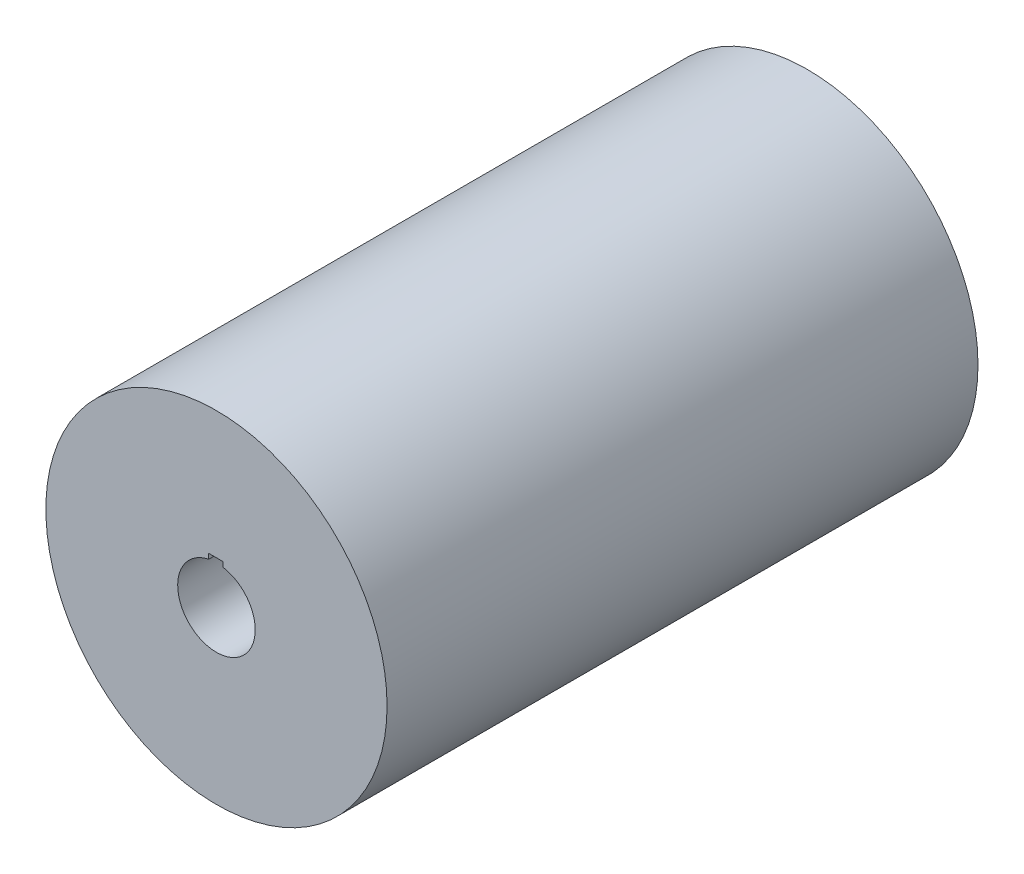
from build123d import *

# Parameters (mm, degrees)
SKETCH15_R               = 11
BOSS_EXTRUDE4_DEPTH      = 50.8
CUT_EXTRUDE9_DEPTH       = 25.4
CUT_EXTRUDE9_DEPTH_BACK  = 50.8
SKETCH16_R               = 5
SKETCH17_R               = 2.5
CUT_EXTRUDE10_DEPTH      = 25.4
SKETCH20_W               = 0.929150013
SKETCH20_H               = 0.563484587
CUT_EXTRUDE11_DEPTH      = 25.4
SKETCH22_R               = 3.175
CUT_EXTRUDE14_DEPTH      = 12
CUT_EXTRUDE15_DEPTH      = 12.7
CUT_EXTRUDE15_DEPTH_BACK = 10
SKETCH33_R               = 11


with BuildPart() as part:
    # Sketch15 → Boss-Extrude4 (new body)
    with BuildSketch(Plane.XY):
        Circle(SKETCH15_R)
    extrude(amount=BOSS_EXTRUDE4_DEPTH)

    # Sketch16 → Cut-Extrude9 (cut, two sides: drawn at the far end of the back side and taken through both)
    with BuildSketch(Plane.XY.offset(-CUT_EXTRUDE9_DEPTH_BACK)):
        Circle(SKETCH16_R)
    extrude(amount=CUT_EXTRUDE9_DEPTH + CUT_EXTRUDE9_DEPTH_BACK, mode=Mode.SUBTRACT)

    # Sketch17 → Cut-Extrude10 (cut)
    with BuildSketch(Plane.XY.offset(50.8)):
        Circle(SKETCH17_R)
    extrude(amount=-CUT_EXTRUDE10_DEPTH, mode=Mode.SUBTRACT)

    # Sketch20 → Cut-Extrude11 (cut)
    with BuildSketch(Plane.XY.offset(50.8)):
        with Locations((-0.035424993, 2.498467219)):
            Rectangle(SKETCH20_W, SKETCH20_H)
    extrude(amount=-CUT_EXTRUDE11_DEPTH, mode=Mode.SUBTRACT)

    # Sketch22 → Cut-Extrude14 (cut)
    with BuildSketch(Plane(origin=(0, 0, 0), x_dir=(1, 0, 0), z_dir=(0, 1, 0))):
        with Locations(Location((0, -39.506560459, 0), (0, 0, 270))):
            Circle(SKETCH22_R)
    extrude(amount=-CUT_EXTRUDE14_DEPTH, mode=Mode.SUBTRACT)

    # Sketch33 → Cut-Extrude15 (cut, two sides: drawn at the far end of the back side and taken through both)
    with BuildSketch(Plane.XY.offset(-CUT_EXTRUDE15_DEPTH_BACK)):
        Circle(SKETCH33_R)
    extrude(amount=CUT_EXTRUDE15_DEPTH + CUT_EXTRUDE15_DEPTH_BACK, mode=Mode.SUBTRACT)


solid = part.part
